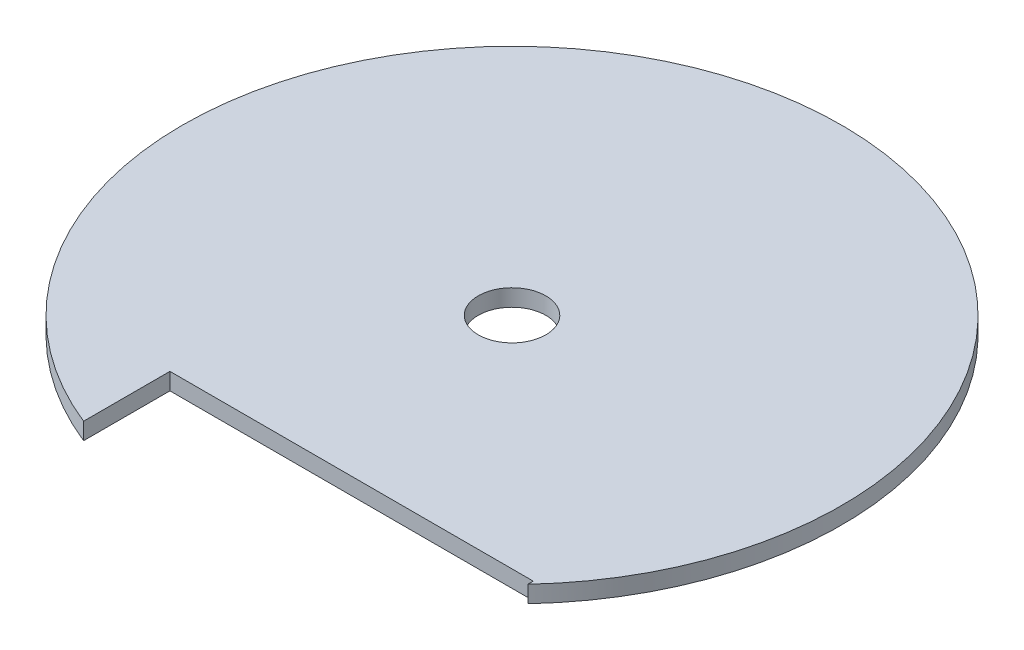
from build123d import *

# Parameters (mm, degrees)
SKETCH1_R           = 39
SKETCH1_R_2         = 4
BOSS_EXTRUDE1_DEPTH = 2
SKETCH2_W           = 43
SKETCH2_H           = 43
CUT_EXTRUDE1_DEPTH  = 56.190578906


with BuildPart() as part:
    # Sketch1 → Boss-Extrude1 (new body)
    with BuildSketch(Plane(origin=(0, 0, 0), x_dir=(1, 0, 0), z_dir=(0, 1, 0))):
        with Locations(Location((0, 0, 0), (0, 0, 270))):
            Circle(SKETCH1_R)
        with Locations(Location((0, 0, 0), (0, 0, 270))):
            Circle(SKETCH1_R_2, mode=Mode.SUBTRACT)
    extrude(amount=BOSS_EXTRUDE1_DEPTH)

    # Sketch2 → Cut-Extrude1 (cut, through all)
    with BuildSketch(Plane(origin=(0, 2, 0), x_dir=(1, 0, 0), z_dir=(0, 1, 0))):
        with Locations((7, -47.486840282)):
            Rectangle(SKETCH2_W, SKETCH2_H)
    extrude(amount=-CUT_EXTRUDE1_DEPTH, mode=Mode.SUBTRACT)


solid = part.part
